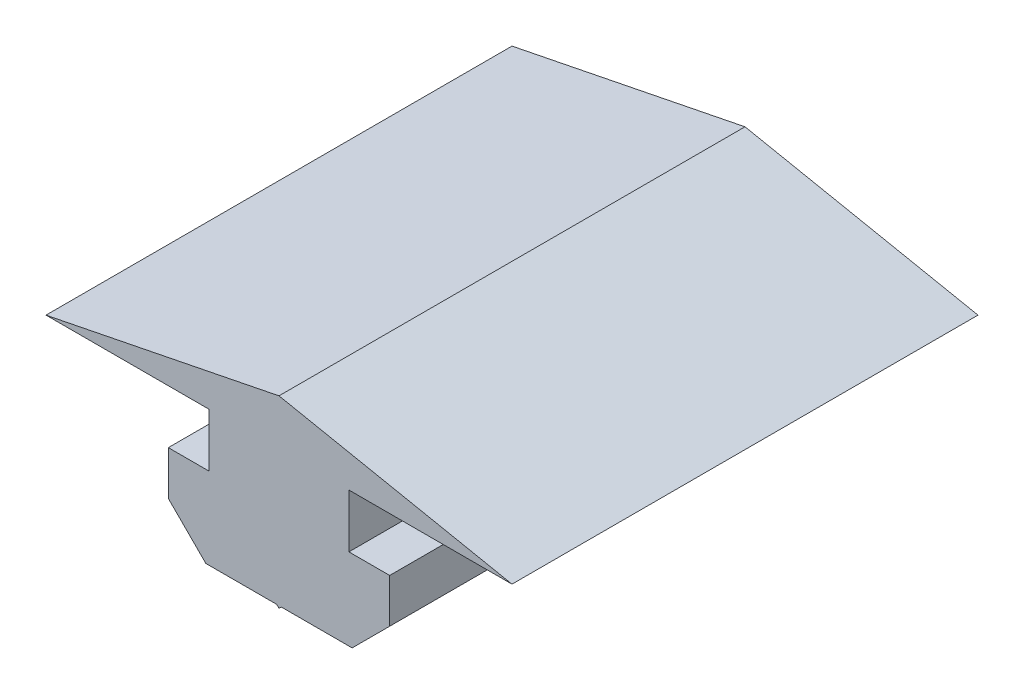
from build123d import *

# Parameters (mm, degrees)
BOSS_EXTRUDE1_DEPTH = 20


with BuildPart() as part:
    # Sketch1 → Boss-Extrude1 (new body)
    with BuildSketch(Plane.XY):
        Polygon((0, 2), (-10, 0), (-4.75, 0), (-3, 0), (0, 0), align=None)
        Polygon((0, 0), (-3, 0), (-3, -1.75), (-3, -1.8), (-3, -2.3), (-4.75, -2.3), (-4.75, -4.189339828), (-3.139339828, -5.8), (-0.1, -5.8), (0, -5.9), (0.1, -5.8), (3.139339828, -5.8), (4.75, -4.189339828), (4.75, -2.3), (3, -2.3), (3, -1.8), (3, -1.75), (3, 0), align=None)
        Polygon((10, 0), (0, 2), (0, 0), (3, 0), (4.75, 0), align=None)
    extrude(amount=BOSS_EXTRUDE1_DEPTH)


solid = part.part
